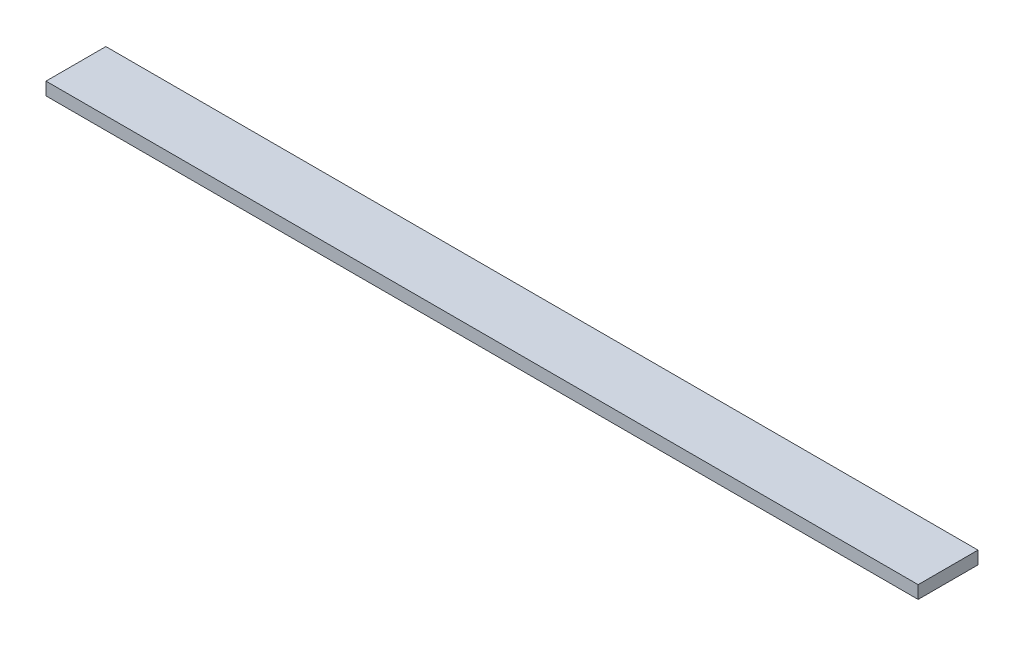
from build123d import *

# Parameters (mm, degrees)
OVEN_PANO_KLEMENS_RAYI_1_START = -213
SKETCH1_W                      = 510
SKETCH1_H                      = 7.5
OVEN_PANO_KLEMENS_RAYI_1_DEPTH = 35


with BuildPart() as part:
    # Sketch1 → OVEN_pano_klemens_rayi_1 (new body)
    with BuildSketch(Plane.XY.offset(OVEN_PANO_KLEMENS_RAYI_1_START)):
        with Locations((385, 143.75)):
            Rectangle(SKETCH1_W, SKETCH1_H)
    extrude(amount=-OVEN_PANO_KLEMENS_RAYI_1_DEPTH)


solid = part.part
